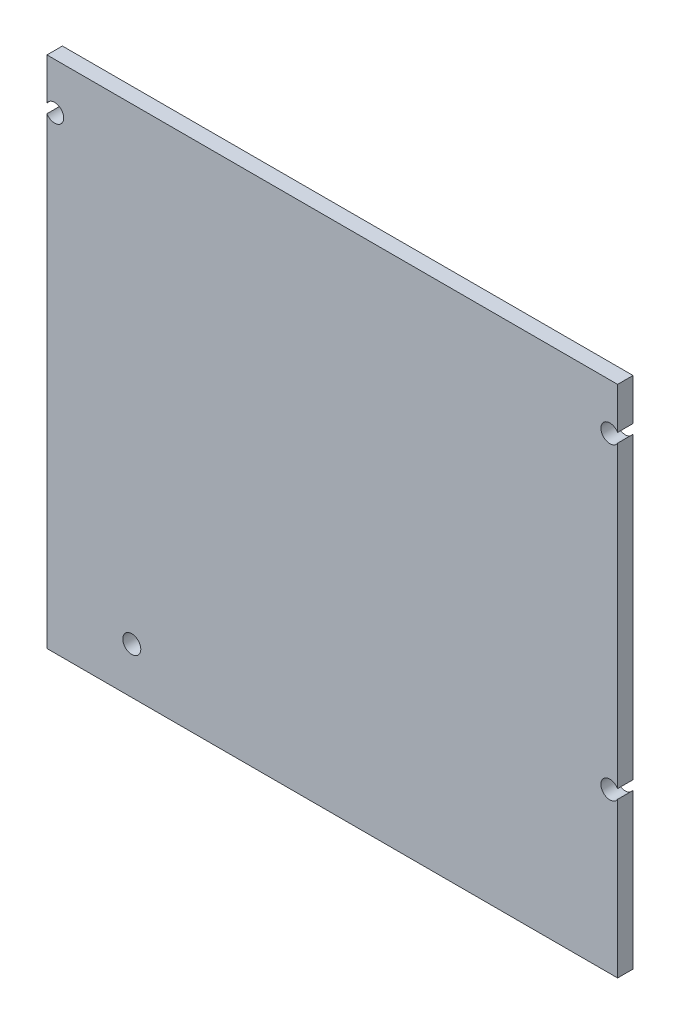
from build123d import *

# Parameters (mm, degrees)
SKETCH1_W                  = 111
SKETCH1_H                  = 100
BOSS_EXTRUDE1_DEPTH        = 3
F_3_5_3_5_DIAMETER_HOLE1_D = 3.5


with BuildPart() as part:
    # Sketch1 → Boss-Extrude1 (new body)
    with BuildSketch(Plane.XY):
        with Locations((-54, -41)):
            Rectangle(SKETCH1_W, SKETCH1_H)
    extrude(amount=BOSS_EXTRUDE1_DEPTH)

    # Ø3.5 (3.5) Diameter Hole1 (through all)
    with Locations(Plane.XY.offset(3)):
        with Locations((0, 0), (-108, 0), (-93, -82), (0, -60)):
            Hole(F_3_5_3_5_DIAMETER_HOLE1_D / 2)


solid = part.part
